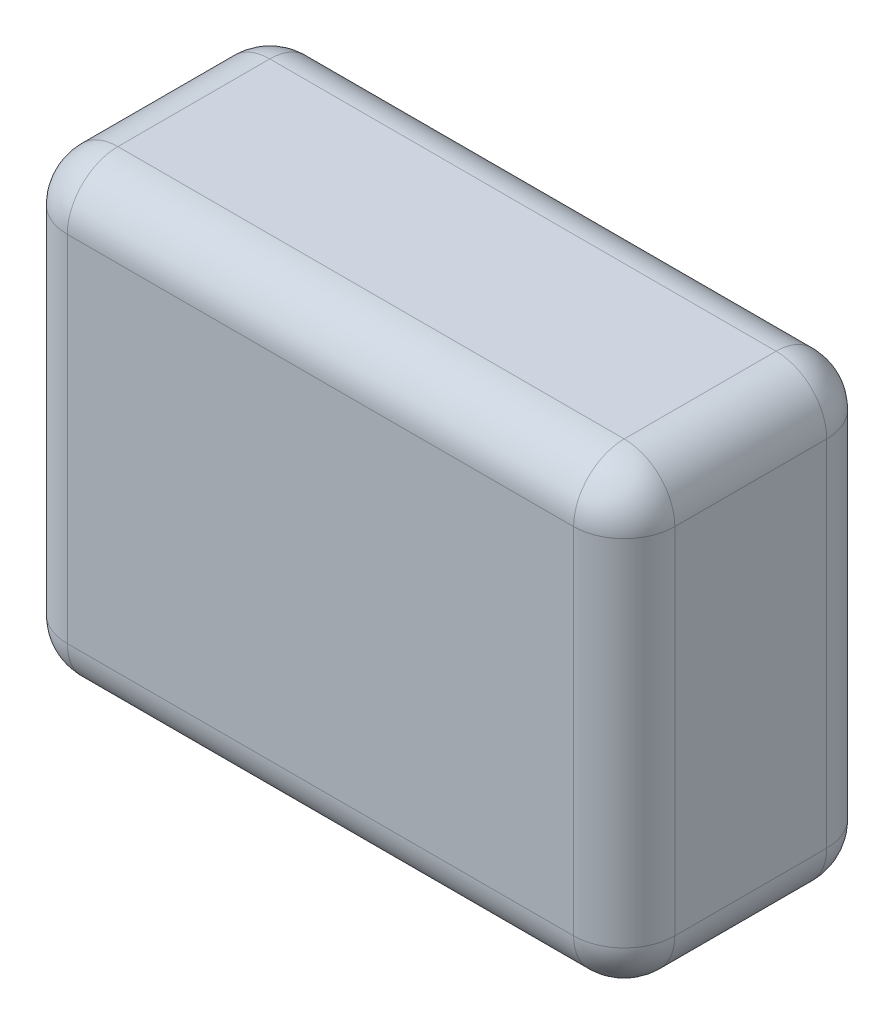
from build123d import *

# Parameters (mm, degrees)
SKETCH1_W           = 120
SKETCH1_H           = 90
BOSS_EXTRUDE1_DEPTH = 50
FILLET1_R           = 10


with BuildPart() as part:
    # Sketch1 → Boss-Extrude1 (new body)
    with BuildSketch(Plane.XY):
        Rectangle(SKETCH1_W, SKETCH1_H)
    extrude(amount=BOSS_EXTRUDE1_DEPTH)

    # Fillet1
    fillet1_edges = [part.edges().sort_by_distance(p)[0] for p in [
        (-60, 0, 50),
        (0, -45, 50),
        (60, 0, 50),
        (0, -45, 0),
        (-60, 0, 0),
        (0, 45, 0),
        (60, 0, 0),
        (0, 45, 50),
        (60, -45, 25),
        (-60, -45, 25),
        (-60, 45, 25),
        (60, 45, 25),
    ]]
    fillet(fillet1_edges, radius=FILLET1_R)


solid = part.part
